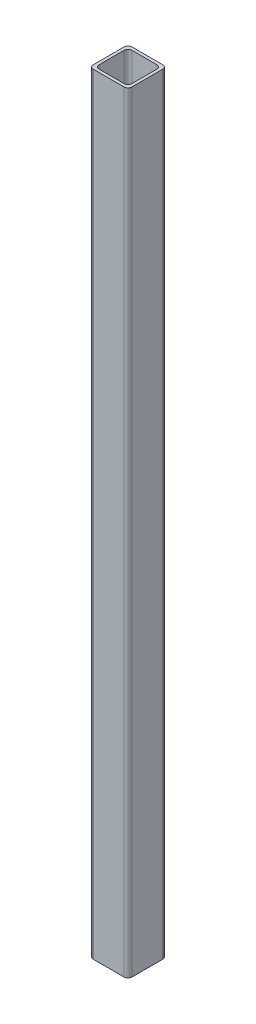
from build123d import *

# Parameters (mm, degrees)
BOSS_EXTRUDE1_DEPTH = 200


with BuildPart() as part:
    # Sketch1 → Boss-Extrude1 (new body)
    with BuildSketch(Plane(origin=(0, 0, 0), x_dir=(1, 0, 0), z_dir=(0, 1, 0))):
        with BuildLine():
            Line((-4, -5), (4, -5))
            ThreePointArc((4, -5), (4.707106781, -4.707106781), (5, -4))
            Line((5, -4), (5, 4))
            ThreePointArc((5, 4), (4.707106781, 4.707106781), (4, 5))
            Line((4, 5), (-4, 5))
            ThreePointArc((-4, 5), (-4.707106781, 4.707106781), (-5, 4))
            Line((-5, 4), (-5, -4))
            ThreePointArc((-5, -4), (-4.707106781, -4.707106781), (-4, -5))
        make_face()
        with BuildLine():
            Line((-3.25, -4.25), (3.25, -4.25))
            ThreePointArc((3.25, -4.25), (3.957106781, -3.957106781), (4.25, -3.25))
            Line((4.25, -3.25), (4.25, 3.25))
            ThreePointArc((4.25, 3.25), (3.957106781, 3.957106781), (3.25, 4.25))
            Line((3.25, 4.25), (-3.25, 4.25))
            ThreePointArc((-3.25, 4.25), (-3.957106781, 3.957106781), (-4.25, 3.25))
            Line((-4.25, 3.25), (-4.25, -3.25))
            ThreePointArc((-4.25, -3.25), (-3.957106781, -3.957106781), (-3.25, -4.25))
        make_face(mode=Mode.SUBTRACT)
    extrude(amount=BOSS_EXTRUDE1_DEPTH)


solid = part.part
